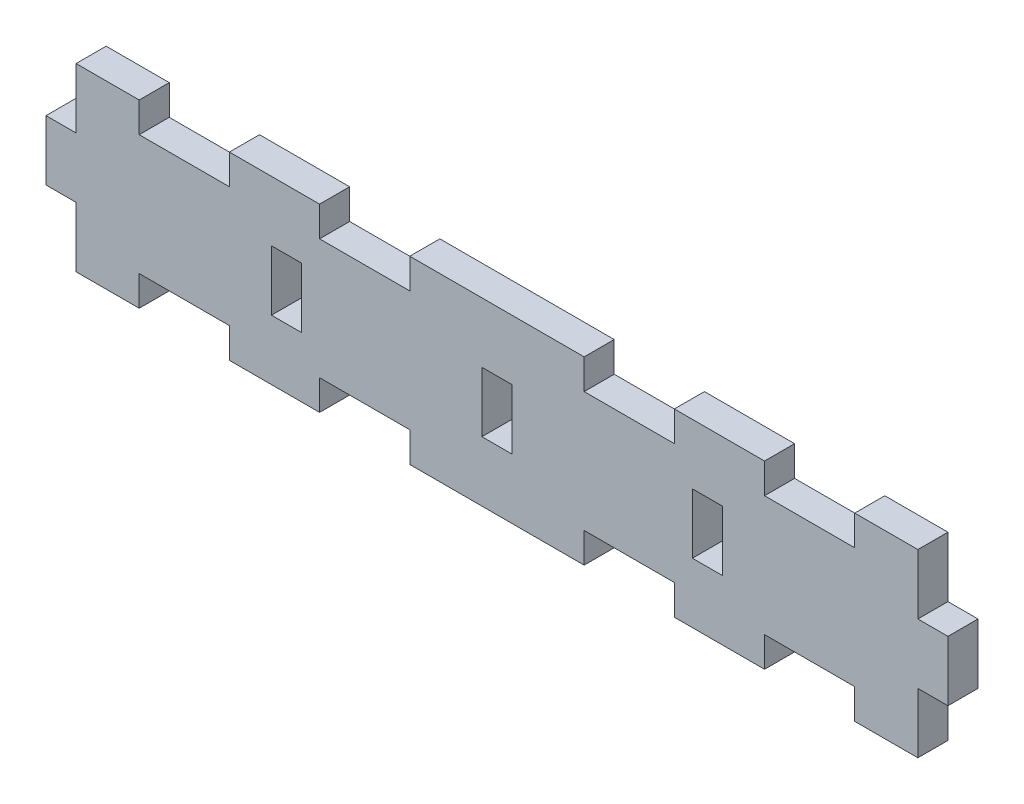
from build123d import *

# Parameters (mm, degrees)
SKETCH1_W           = 5
SKETCH1_H           = 10
BOSS_EXTRUDE1_DEPTH = 5


with BuildPart() as part:
    # Sketch1 → Boss-Extrude1 (new body)
    with BuildSketch(Plane.XY):
        Polygon((46.402376673, -17.999000463), (46.402376673, -22.999000463), (51.402376673, -22.999000463), (51.402376673, -32.999000463), (46.402376673, -32.999000463), (46.402376673, -37.999000463), (46.402376673, -42.999000463), (35.902376673, -42.999000463), (35.902376673, -37.999000463), (20.902376673, -37.999000463), (20.902376673, -42.999000463), (5.902376673, -42.999000463), (5.902376673, -37.999000463), (-9.097623327, -37.999000463), (-9.097623327, -42.999000463), (-38.097623327, -42.999000463), (-38.097623327, -37.999000463), (-53.097623327, -37.999000463), (-53.097623327, -42.999000463), (-68.097623327, -42.999000463), (-68.097623327, -37.999000463), (-83.097623327, -37.999000463), (-83.097623327, -42.999000463), (-93.597623327, -42.999000463), (-93.597623327, -37.999000463), (-93.597623327, -32.999000463), (-98.597623326, -32.999000463), (-98.597623326, -22.999000463), (-93.597623327, -22.999000463), (-93.597623327, -17.999000463), (-93.597623327, -12.999000463), (-83.097623327, -12.999000463), (-83.097623327, -17.999000463), (-68.097623327, -17.999000463), (-68.097623327, -12.999000463), (-53.097623327, -12.999000463), (-53.097623327, -17.999000463), (-38.097623327, -17.999000463), (-38.097623327, -12.999000463), (-9.097623327, -12.999000463), (-9.097623327, -17.999000463), (5.902376673, -17.999000463), (5.902376673, -12.999000463), (20.902376673, -12.999000463), (20.902376673, -17.999000463), (35.902376673, -17.999000463), (35.902376673, -12.999000463), (46.402376673, -12.999000463), align=None)
        with Locations((11.402376673, -27.999000463)):
            Rectangle(SKETCH1_W, SKETCH1_H, mode=Mode.SUBTRACT)
        with Locations((-23.597623327, -27.999000463)):
            Rectangle(SKETCH1_W, SKETCH1_H, mode=Mode.SUBTRACT)
        with Locations((-58.597623327, -27.999000463)):
            Rectangle(SKETCH1_W, SKETCH1_H, mode=Mode.SUBTRACT)
    extrude(amount=BOSS_EXTRUDE1_DEPTH)


solid = part.part
